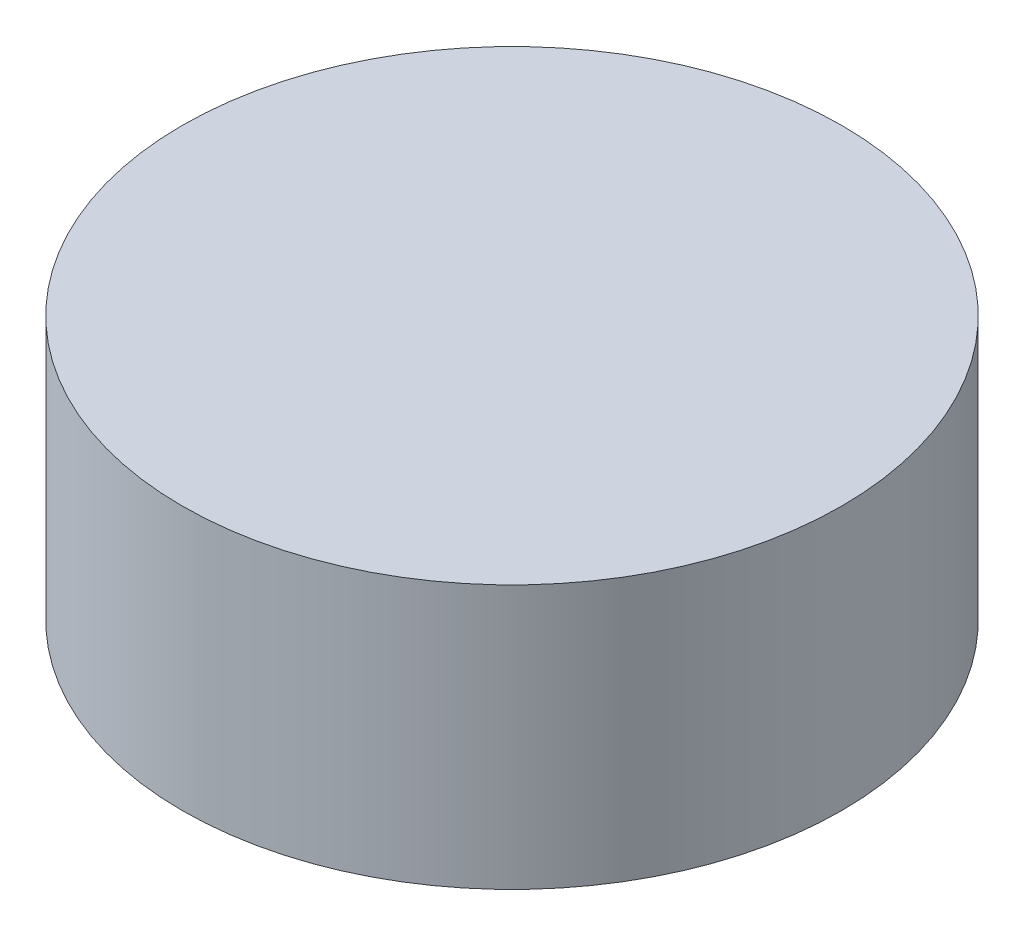
from build123d import *

# Parameters (mm, degrees)
SKETCH1_R           = 3.75
BOSS_EXTRUDE1_DEPTH = 3


with BuildPart() as part:
    # Sketch1 → Boss-Extrude1 (new body)
    with BuildSketch(Plane(origin=(0, 0, 0), x_dir=(1, 0, 0), z_dir=(0, 1, 0))):
        with Locations(Location((0, 0, 0), (0, 0, 270))):
            Circle(SKETCH1_R)
    extrude(amount=BOSS_EXTRUDE1_DEPTH)


solid = part.part
